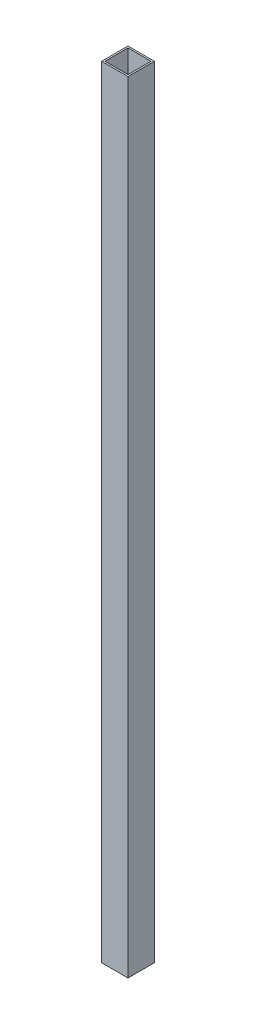
from build123d import *

# Parameters (mm, degrees)
SKETCH1_W           = 19
SKETCH1_H           = 19
SKETCH1_W_2         = 16.6
SKETCH1_H_2         = 16.6
BOSS_EXTRUDE1_DEPTH = 562


with BuildPart() as part:
    # Sketch1 → Boss-Extrude1 (new body)
    with BuildSketch(Plane(origin=(0, 0, 0), x_dir=(1, 0, 0), z_dir=(0, 1, 0))):
        with Locations((9.5, -9.5)):
            Rectangle(SKETCH1_W, SKETCH1_H)
        with Locations((9.5, -9.5)):
            Rectangle(SKETCH1_W_2, SKETCH1_H_2, mode=Mode.SUBTRACT)
    extrude(amount=BOSS_EXTRUDE1_DEPTH)


solid = part.part
